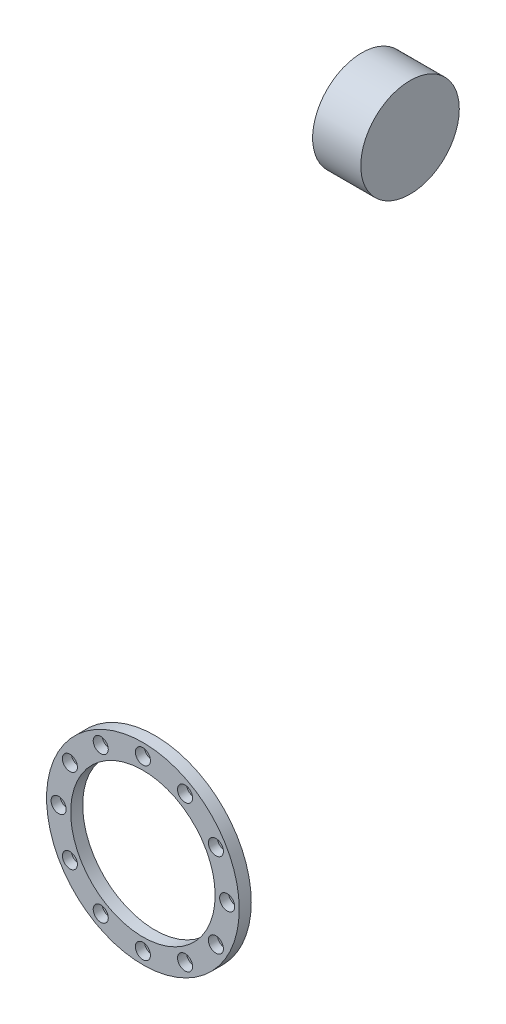
from build123d import *

# Parameters (mm, degrees)
SKETCH1_R                                        = 101.6
SKETCH1_R_2                                      = 76.2
BOSS_EXTRUDE1_DEPTH                              = 12.7
CBORE_FOR_3_8_SOCKET_HEAD_CAP_SCREW1_D           = 10.0838
CBORE_FOR_3_8_SOCKET_HEAD_CAP_SCREW1_CBORE_D     = 15.875
CBORE_FOR_3_8_SOCKET_HEAD_CAP_SCREW1_CBORE_DEPTH = 9.525
CIRPATTERN1_COUNT                                = 12
SKETCH5_R                                        = 51.945375868
BOSS_EXTRUDE2_DEPTH                              = 25.4


with BuildPart() as part:
    # Sketch1 → Boss-Extrude1 (new body)
    with BuildSketch(Plane.XY):
        Circle(SKETCH1_R)
        Circle(SKETCH1_R_2, mode=Mode.SUBTRACT)
    extrude(amount=BOSS_EXTRUDE1_DEPTH)

    # CBORE for 3/8 Socket Head Cap Screw1 (through all)
    with Locations(Plane.XY.offset(12.7)):
        with Locations((0, 88.9)):
            cbore_for_3_8_socket_head_cap_screw1 = CounterBoreHole(CBORE_FOR_3_8_SOCKET_HEAD_CAP_SCREW1_D / 2, CBORE_FOR_3_8_SOCKET_HEAD_CAP_SCREW1_CBORE_D / 2, CBORE_FOR_3_8_SOCKET_HEAD_CAP_SCREW1_CBORE_DEPTH)

    # CirPattern1: CBORE for 3/8 Socket Head Cap Screw1 ×12 about axis
    cirpattern1_axis = Axis((0, 0, 0), (0, 0, 1))
    for i in range(1, CIRPATTERN1_COUNT):
        add(cbore_for_3_8_socket_head_cap_screw1.rotate(cirpattern1_axis, i * 360 / CIRPATTERN1_COUNT), mode=Mode.SUBTRACT)


with BuildPart() as body_2:
    # Sketch5 → Boss-Extrude2 (new, symmetric)
    with BuildSketch(Plane(origin=(0, 0, 0), x_dir=(0, 0, -1), z_dir=(1, 0, 0))):
        with Locations((243.653729545, 538.724850835)):
            Circle(SKETCH5_R)
    extrude(amount=BOSS_EXTRUDE2_DEPTH, both=True)


solid = Compound([part.part, body_2.part])
